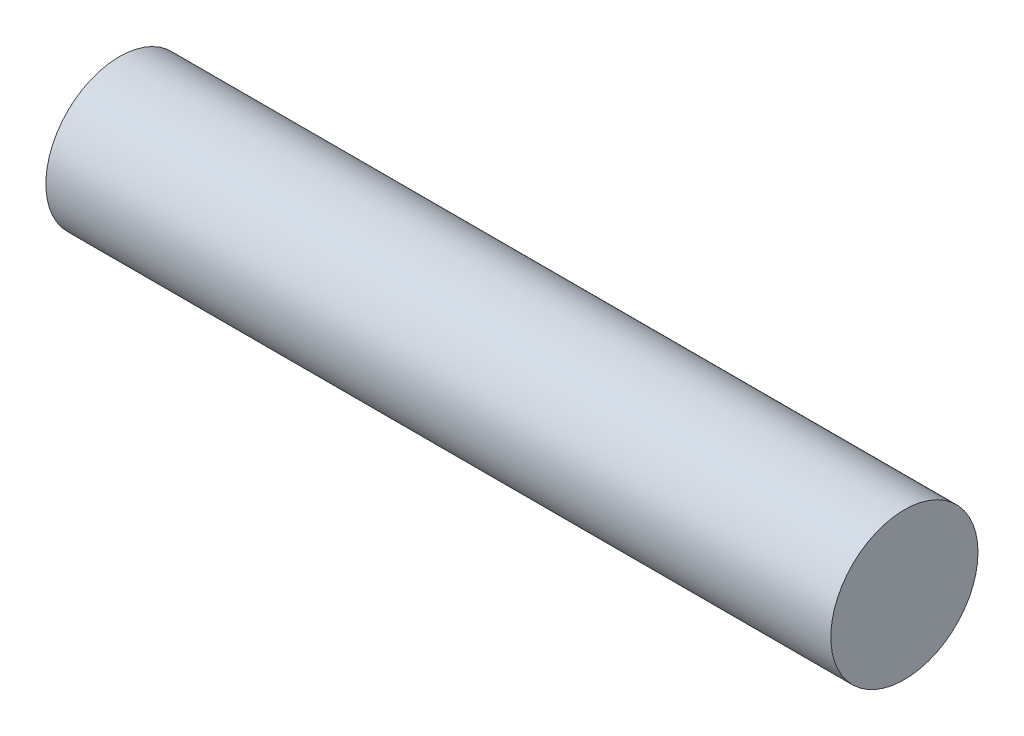
from build123d import *

# Parameters (mm, degrees)
SKETCH1_W           = 120.675
SKETCH1_H           = 1.5875
SKETCH6_R           = 7.9375
BOSS_EXTRUDE1_DEPTH = 101.6
SKETCH7_R           = 23.308025585
CUT_EXTRUDE3_DEPTH  = 19.075


with BuildPart() as part:
    # Sketch1 → Revolve1 (revolve)
    with BuildSketch(Plane(origin=(0, 0, 0), x_dir=(1, 0, 0), z_dir=(0, 1, 0))):
        with Locations((79.5875, 8.73125)):
            Rectangle(SKETCH1_W, SKETCH1_H)
    revolve(axis=Axis((157.324, 0, 0), (-1, 0, 0)))

    # Sketch6 → Boss-Extrude1 (add)
    with BuildSketch(Plane.ZY.offset(-19.25)):
        with Locations(Location((0, 0, 0), (0, 0, 180))):
            Circle(SKETCH6_R)
    extrude(amount=-BOSS_EXTRUDE1_DEPTH)

    # Sketch7 → Cut-Extrude3 (cut)
    with BuildSketch(Plane(origin=(120.85, 0, 0), x_dir=(0, 0, -1), z_dir=(1, 0, 0))):
        Circle(SKETCH7_R)
    extrude(amount=CUT_EXTRUDE3_DEPTH, mode=Mode.SUBTRACT)


solid = part.part
